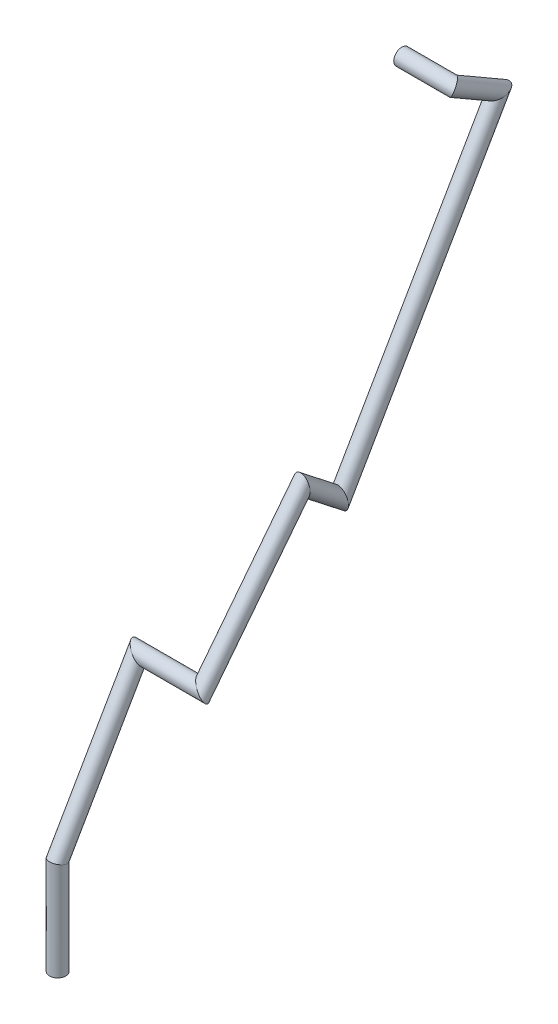
from build123d import *

# Parameters (mm, degrees)
SWEEP1_PROFILE_R = 2.5


with BuildPart() as part:
    # Sweep1: sweep along a curve in space
    with BuildLine() as sweep1_path:
        Line((0, 0, 0), (0, 30, 0))
        Line((0, 30, 0), (0, 73.301270189, -25))
        Line((0, 73.301270189, -25), (20, 73.301270189, -25))
        Line((20, 73.301270189, -25), (20, 112.70180787, -55.783073766))
        Line((20, 112.70180787, -55.783073766), (20, 103.46688574, -67.60323507))
        Line((20, 103.46688574, -67.60323507), (20, 188.337375311, -116.60323507))
        Line((20, 188.337375311, -116.60323507), (20, 196.337375311, -102.74682861))
        Line((20, 196.337375311, -102.74682861), (3.978461048, 196.337375311, -102.74682861))
    # Sweep1 profile (on start of the path) → Sweep1 (sweep)
    with BuildSketch(Plane.ZX):
        Circle(SWEEP1_PROFILE_R)
    sweep(path=sweep1_path.line, transition=Transition.RIGHT)


solid = part.part
